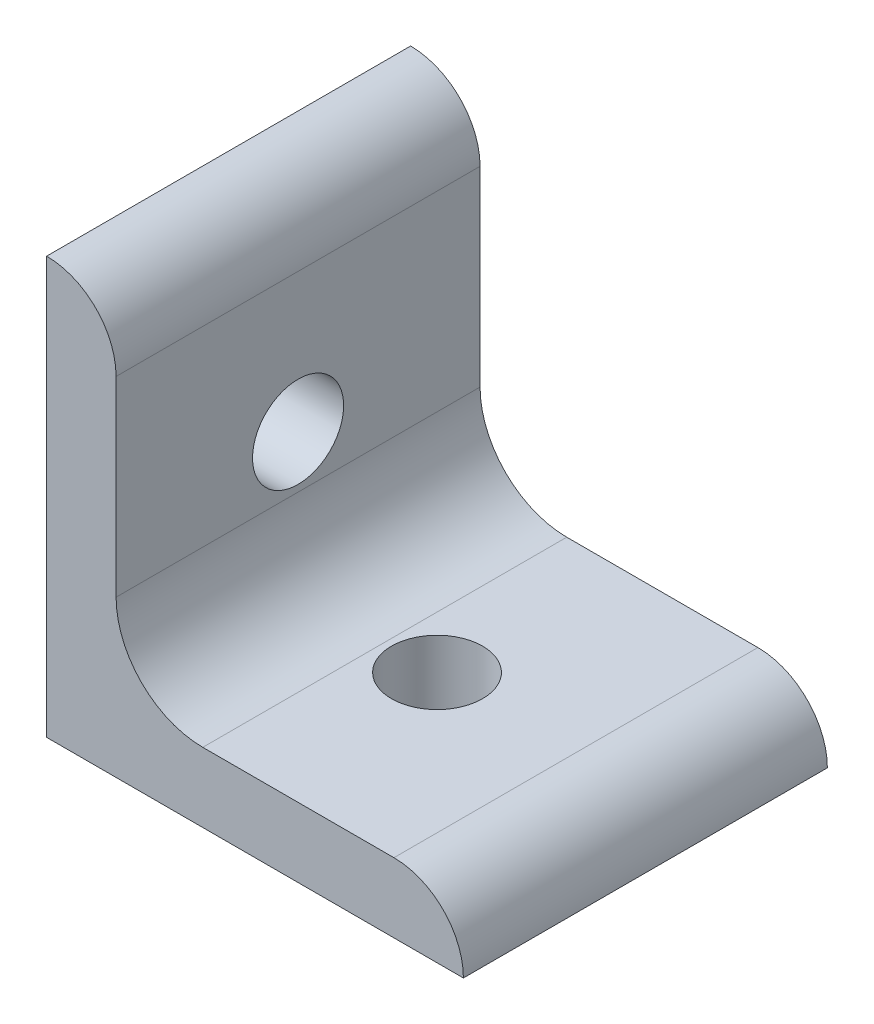
from build123d import *

# Parameters (mm, degrees)
BOSS_EXTRUDE1_DEPTH = 16.637
SKETCH2_R           = 4.1656
CUT_EXTRUDE1_DEPTH  = 57.391575337
SKETCH3_R           = 4.1656
CUT_EXTRUDE2_DEPTH  = 57.391575337


with BuildPart() as part:
    # Sketch1 → Boss-Extrude1 (new, symmetric)
    with BuildSketch(Plane.XY):
        with BuildLine():
            Line((0, 0), (0, 38.1))
            ThreePointArc((0, 38.1), (4.490128061, 36.240128061), (6.35, 31.75))
            Line((6.35, 31.75), (6.35, 14.2748))
            ThreePointArc((6.35, 14.2748), (8.67112018, 8.67112018), (14.2748, 6.35))
            Line((14.2748, 6.35), (31.75, 6.35))
            ThreePointArc((31.75, 6.35), (36.240128061, 4.490128061), (38.1, 0))
            Line((38.1, 0), (0, 0))
        make_face()
    extrude(amount=BOSS_EXTRUDE1_DEPTH, both=True)

    # Sketch2 → Cut-Extrude1 (cut, through all)
    with BuildSketch(Plane(origin=(0, 0, 0), x_dir=(1, 0, 0), z_dir=(0, 1, 0))):
        with Locations(Location((19.05, 0, 0), (0, 0, 90))):
            Circle(SKETCH2_R)
    extrude(amount=CUT_EXTRUDE1_DEPTH, mode=Mode.SUBTRACT)

    # Sketch3 → Cut-Extrude2 (cut, through all)
    with BuildSketch(Plane(origin=(0, 0, 0), x_dir=(0, 0, -1), z_dir=(1, 0, 0))):
        with Locations(Location((0, 19.05, 0), (0, 0, 180))):
            Circle(SKETCH3_R)
    extrude(amount=CUT_EXTRUDE2_DEPTH, mode=Mode.SUBTRACT)


solid = part.part
